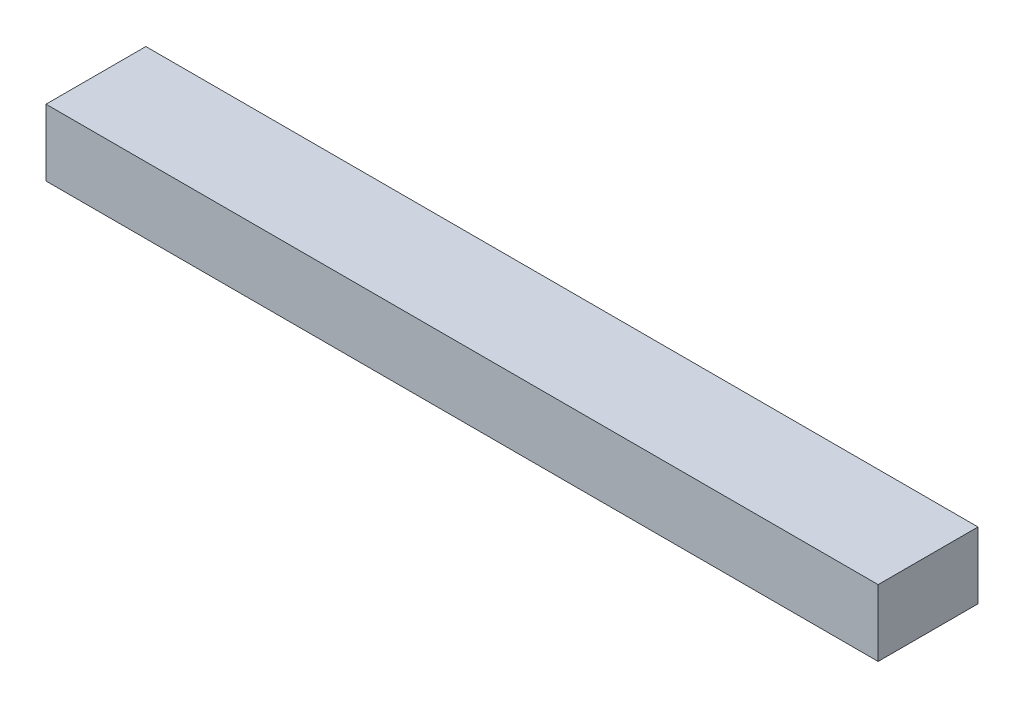
from build123d import *

# Parameters (mm, degrees)
SKETCH1_W           = 100
SKETCH1_H           = 12
BOSS_EXTRUDE1_DEPTH = 8


with BuildPart() as part:
    # Sketch1 → Boss-Extrude1 (new body)
    with BuildSketch(Plane(origin=(0, 0, 0), x_dir=(1, 0, 0), z_dir=(0, 1, 0))):
        Rectangle(SKETCH1_W, SKETCH1_H)
    extrude(amount=BOSS_EXTRUDE1_DEPTH)


solid = part.part
